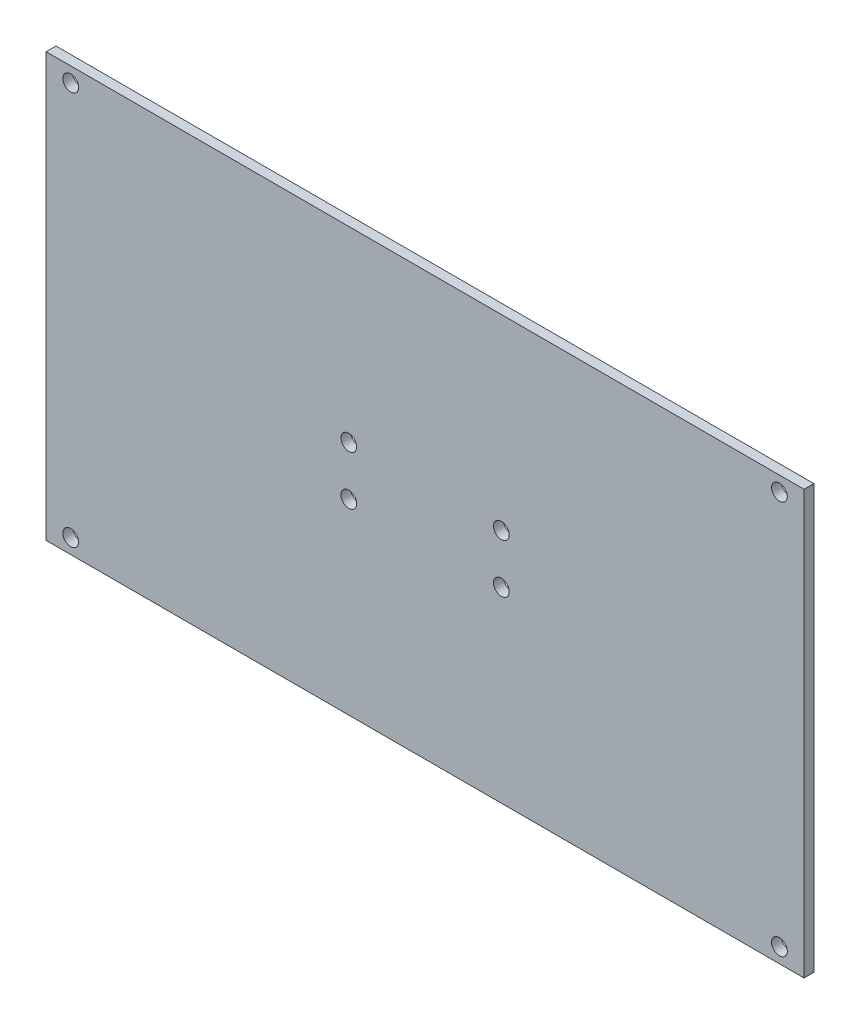
from build123d import *

# Parameters (mm, degrees)
SKETCH_1_W          = 154
SKETCH_1_H          = 86
SKETCH_1_R          = 1.6
EXTRUDE_1_DEPTH     = 2
CUT_EXTRUDE_1_REACH = 183.659
SKETCH_2_R          = 1.6


with BuildPart() as part:
    # 草图1 → 凸台-拉伸1 (new body)
    with BuildSketch(Plane.XY):
        with Locations((-83, 43)):
            Rectangle(SKETCH_1_W, SKETCH_1_H)
        with Locations(Location((-155, 3, 0), (0, 0, 180))):
            Circle(SKETCH_1_R, mode=Mode.SUBTRACT)
        with Locations((-11, 3)):
            Circle(SKETCH_1_R, mode=Mode.SUBTRACT)
        with Locations((-11, 83)):
            Circle(SKETCH_1_R, mode=Mode.SUBTRACT)
        with Locations((-155, 83)):
            Circle(SKETCH_1_R, mode=Mode.SUBTRACT)
    extrude(amount=EXTRUDE_1_DEPTH)

    # 草图2 → 切除-拉伸1 (cut, up to next)
    with BuildSketch(Plane.XY.offset(2), mode=Mode.PRIVATE) as cut_extrude_1_sk1:
        with Locations((-98.5, 48)):
            Circle(SKETCH_2_R)
    cut_extrude_1_tool1 = extrude(cut_extrude_1_sk1.sketch, amount=-CUT_EXTRUDE_1_REACH, mode=Mode.PRIVATE) & part.part
    # 草图2 → 切除-拉伸1 (cut, up to next)
    with BuildSketch(Plane.XY.offset(2), mode=Mode.PRIVATE) as cut_extrude_1_sk2:
        with Locations((-67.5, 48)):
            Circle(SKETCH_2_R)
    cut_extrude_1_tool2 = extrude(cut_extrude_1_sk2.sketch, amount=-CUT_EXTRUDE_1_REACH, mode=Mode.PRIVATE) & part.part
    # 草图2 → 切除-拉伸1 (cut, up to next)
    with BuildSketch(Plane.XY.offset(2), mode=Mode.PRIVATE) as cut_extrude_1_sk3:
        with Locations((-67.5, 38)):
            Circle(SKETCH_2_R)
    cut_extrude_1_tool3 = extrude(cut_extrude_1_sk3.sketch, amount=-CUT_EXTRUDE_1_REACH, mode=Mode.PRIVATE) & part.part
    # 草图2 → 切除-拉伸1 (cut, up to next)
    with BuildSketch(Plane.XY.offset(2), mode=Mode.PRIVATE) as cut_extrude_1_sk4:
        with Locations((-98.5, 38)):
            Circle(SKETCH_2_R)
    cut_extrude_1_tool4 = extrude(cut_extrude_1_sk4.sketch, amount=-CUT_EXTRUDE_1_REACH, mode=Mode.PRIVATE) & part.part
    add(cut_extrude_1_tool1.solids().sort_by_distance((-98.5, 48, 2))[0], mode=Mode.SUBTRACT)
    add(cut_extrude_1_tool2.solids().sort_by_distance((-67.5, 48, 2))[0], mode=Mode.SUBTRACT)
    add(cut_extrude_1_tool3.solids().sort_by_distance((-67.5, 38, 2))[0], mode=Mode.SUBTRACT)
    add(cut_extrude_1_tool4.solids().sort_by_distance((-98.5, 38, 2))[0], mode=Mode.SUBTRACT)


solid = part.part
